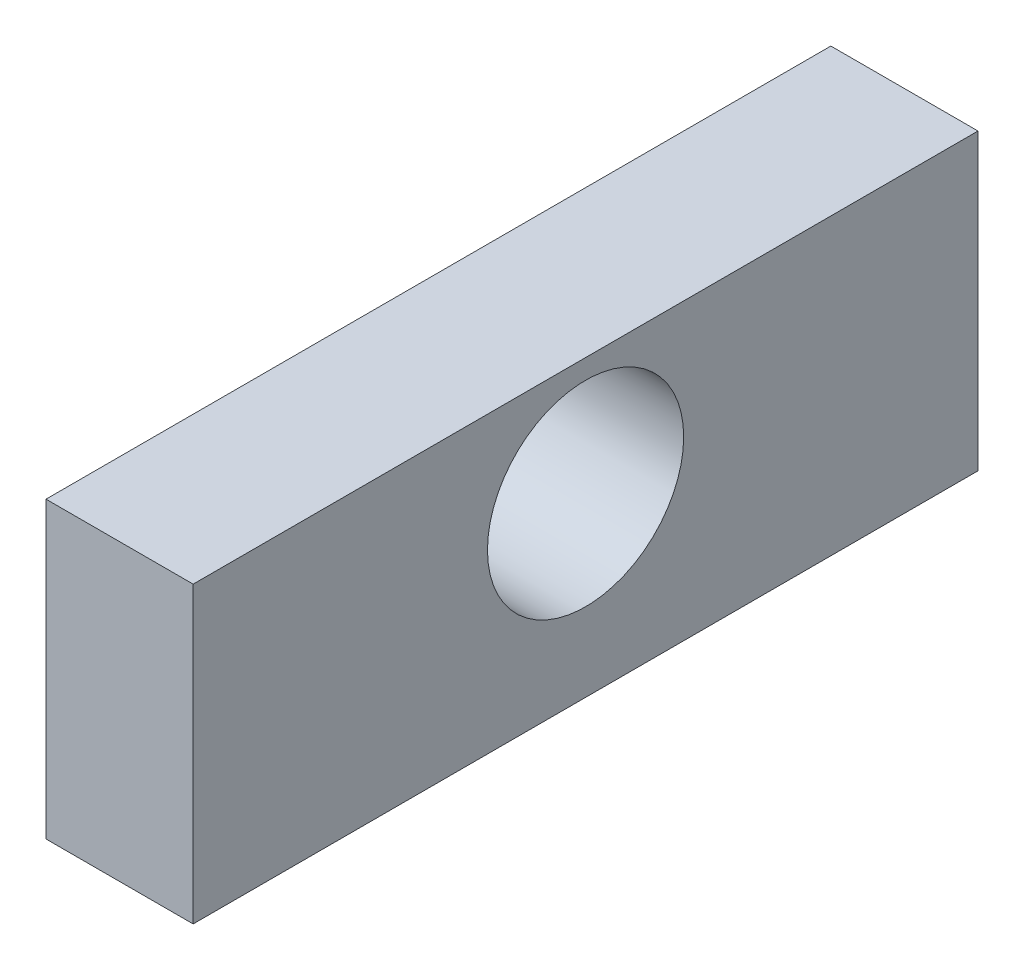
from build123d import *

# Parameters (mm, degrees)
SKETCH1_W                      = 50.8
SKETCH1_H                      = 19.05
BOSS_EXTRUDE1_DEPTH            = 9.525
F_1_2_0_5_DIAMETER_HOLE1_D     = 12.7
F_1_2_0_5_DIAMETER_HOLE1_DEPTH = 70.104
F_1_2_0_5_DIAMETER_HOLE1_TIP   = 3.815464931
F_10_32_TAPPED_HOLE1_D         = 4.0386
F_10_32_TAPPED_HOLE1_DEPTH     = 11.938
F_10_32_TAPPED_HOLE1_TIP       = 1.213317848


with BuildPart() as part:
    # Sketch1 → Boss-Extrude1 (new body)
    with BuildSketch(Plane(origin=(0, 0, 0), x_dir=(0, 0, -1), z_dir=(1, 0, 0))):
        Rectangle(SKETCH1_W, SKETCH1_H)
    extrude(amount=BOSS_EXTRUDE1_DEPTH)

    # 1/2 (0.5) Diameter Hole1
    with Locations(Plane(origin=(9.525, 0, 0), x_dir=(0, 0, -1), z_dir=(1, 0, 0))):
        with Locations((0, 1.905)):
            Hole(F_1_2_0_5_DIAMETER_HOLE1_D / 2, depth=F_1_2_0_5_DIAMETER_HOLE1_DEPTH)
            with Locations((0, 0, -(F_1_2_0_5_DIAMETER_HOLE1_DEPTH + F_1_2_0_5_DIAMETER_HOLE1_TIP / 2))):  # 118° drill point
                Cone(0, F_1_2_0_5_DIAMETER_HOLE1_D / 2, F_1_2_0_5_DIAMETER_HOLE1_TIP, mode=Mode.SUBTRACT)

    # #10-32 Tapped Hole1
    with Locations(Plane(origin=(-1.022565875, -1.088669914, -25.4), x_dir=(-1, 0, 0), z_dir=(0, 0, -1))):
        with Locations((-5.785065875, -2.086330086), (-5.785065875, 6.803669914)):
            Hole(F_10_32_TAPPED_HOLE1_D / 2, depth=F_10_32_TAPPED_HOLE1_DEPTH)
            with Locations((0, 0, -(F_10_32_TAPPED_HOLE1_DEPTH + F_10_32_TAPPED_HOLE1_TIP / 2))):  # 118° drill point
                Cone(0, F_10_32_TAPPED_HOLE1_D / 2, F_10_32_TAPPED_HOLE1_TIP, mode=Mode.SUBTRACT)


solid = part.part
